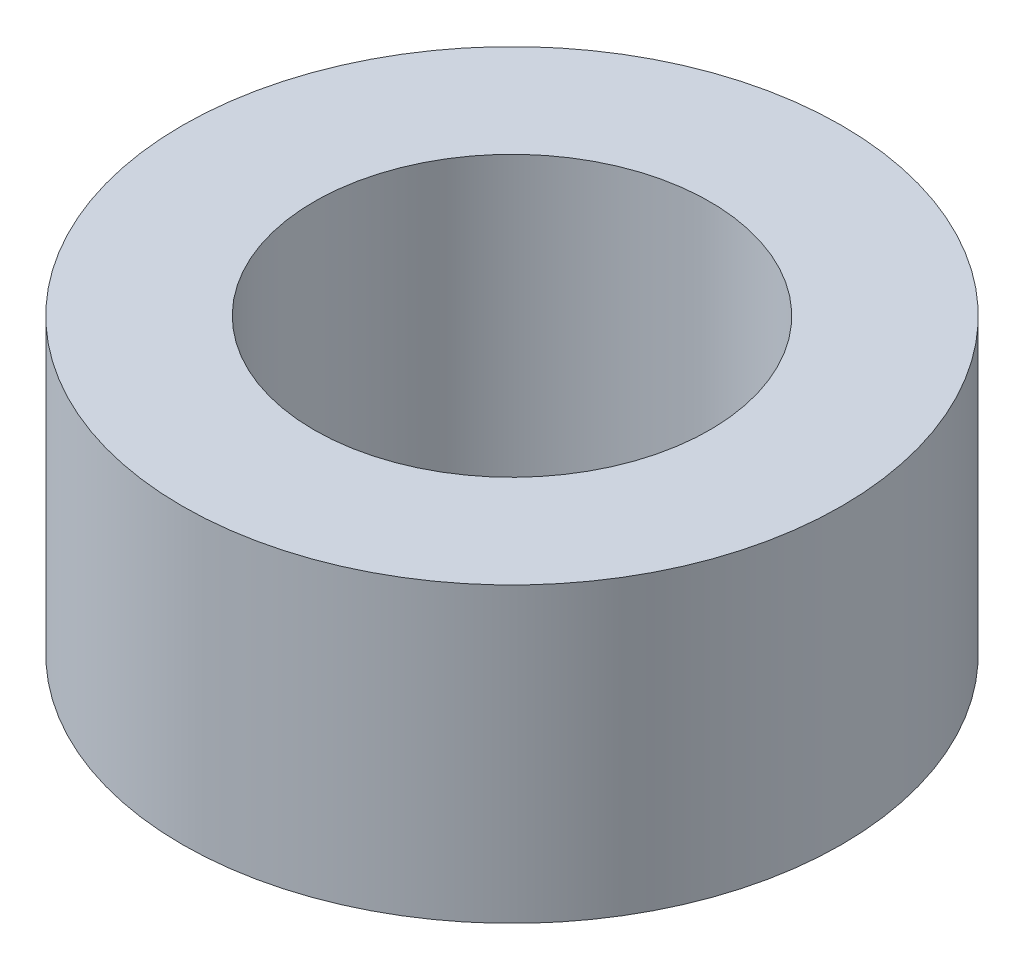
from build123d import *

# Parameters (mm, degrees)
SKETCH1_R           = 2.25
SKETCH1_R_2         = 1.35
BOSS_EXTRUDE1_DEPTH = 2


with BuildPart() as part:
    # Sketch1 → Boss-Extrude1 (new body)
    with BuildSketch(Plane(origin=(0, 0, 0), x_dir=(1, 0, 0), z_dir=(0, 1, 0))):
        with Locations(Location((0, 0, 0), (0, 0, 270))):
            Circle(SKETCH1_R)
        with Locations(Location((0, 0, 0), (0, 0, 270))):
            Circle(SKETCH1_R_2, mode=Mode.SUBTRACT)
    extrude(amount=BOSS_EXTRUDE1_DEPTH)


solid = part.part
